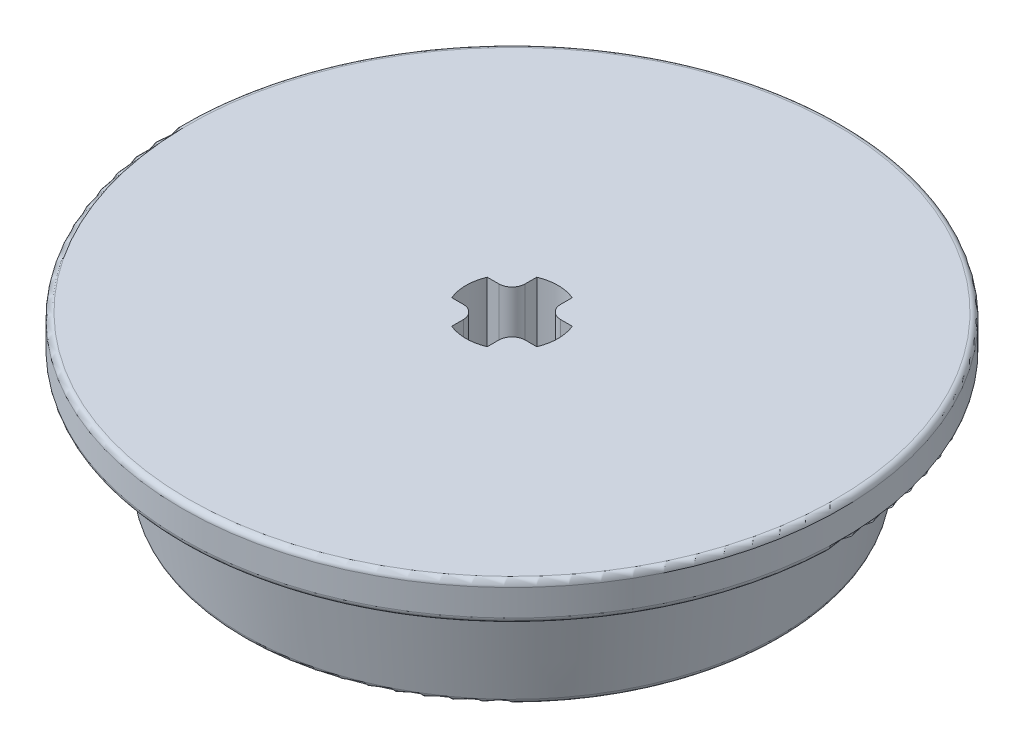
from build123d import *

# Parameters (mm, degrees)
CUT_EXTRUDE1_DEPTH = 26.956426849
FILLET1_R          = 0.7
FILLET2_R          = 0.3


with BuildPart() as part:
    # Sketch2 → Revolve1 (revolve)
    with BuildSketch(Plane.XY, mode=Mode.PRIVATE) as revolve1_sk:
        Polygon((0, 0), (17.460470996, 0), (17.460470996, -2), (15, -2), (14.156754992, -8), (0, -8), align=None)
    revolve(revolve1_sk.sketch.rotate(Axis((0, 0, 0), (0, 1, 0)), 90), axis=Axis((0, 0, 0), (0, 1, 0)))

    # Sketch1 → Cut-Extrude1 (cut, through all)
    with BuildSketch(Plane(origin=(0, 0, 0), x_dir=(1, 0, 0), z_dir=(0, 1, 0))):
        with BuildLine():
            Line((-0.94, 0.94), (-2.25166605, 0.94))
            ThreePointArc((-2.25166605, 0.94), (-2.44, 0), (-2.25166605, -0.94))
            Line((-2.25166605, -0.94), (-0.94, -0.94))
            Line((-0.94, -0.94), (-0.94, -2.25166605))
            ThreePointArc((-0.94, -2.25166605), (0, -2.44), (0.94, -2.25166605))
            Line((0.94, -2.25166605), (0.94, -0.94))
            Line((0.94, -0.94), (2.25166605, -0.94))
            ThreePointArc((2.25166605, -0.94), (2.44, 0), (2.25166605, 0.94))
            Line((2.25166605, 0.94), (0.94, 0.94))
            Line((0.94, 0.94), (0.94, 2.25166605))
            ThreePointArc((0.94, 2.25166605), (0, 2.44), (-0.94, 2.25166605))
            Line((-0.94, 2.25166605), (-0.94, 0.94))
        make_face()
    extrude(amount=-CUT_EXTRUDE1_DEPTH, mode=Mode.SUBTRACT)

    # Fillet1
    fillet1_edges = [part.edges().sort_by_distance(p)[0] for p in [
        (-0.94, -4, -0.94),
        (0.94, -4, -0.94),
        (0.94, -4, 0.94),
        (-0.94, -4, 0.94),
    ]]
    fillet(fillet1_edges, radius=FILLET1_R)

    # Fillet2
    fillet2_edges = [part.edges().sort_by_distance(p)[0] for p in [
        (0, -8, 14.156754992),
        (0, -2, 15),
        (0, -2, 17.460470996),
        (0, 0, 17.460470996),
    ]]
    fillet(fillet2_edges, radius=FILLET2_R)


solid = part.part
